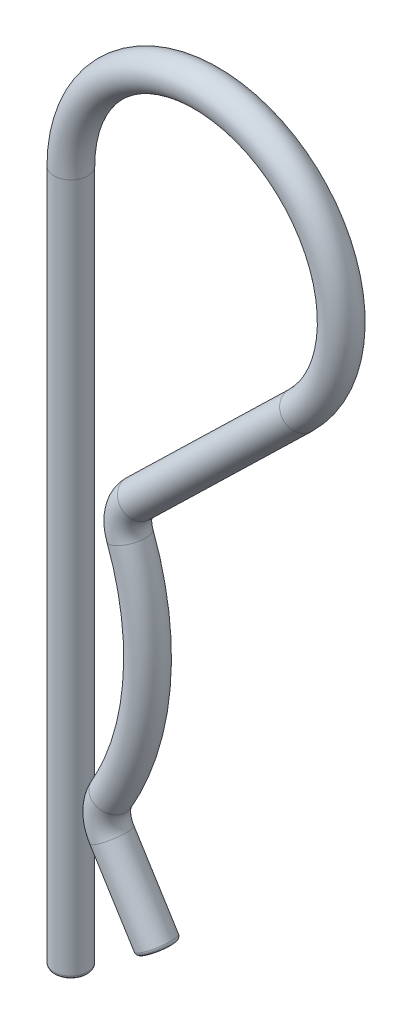
from build123d import *

# Parameters (mm, degrees)
SKETCH_2_R = 1
FILLET_1_R = 0.2


with BuildPart() as part:
    # По траектории1: sweep along a path in Эскиз1
    with BuildLine(Plane.XY) as sweep_1_path:
        Line((-8, -41), (-8, 0))
        ThreePointArc((-8, 0), (3.116806143, 7.367870755), (5.571379866, -5.741056208))
        Line((5.571379866, -5.741056208), (-4.024408845, -15.053242344))
        ThreePointArc((-4.024408845, -15.053242344), (-4.583248798, -16.051555626), (-4.503433283, -17.192853565))
        ThreePointArc((-4.503433283, -17.192853565), (-3.513765144, -24.223447922), (-5.613584589, -31.005737973))
        ThreePointArc((-5.613584589, -31.005737973), (-5.877887723, -32.037194469), (-5.57540957, -33.058108577))
        Line((-5.57540957, -33.058108577), (-2.829700409, -37.462147711))
    # Эскиз2 → По траектории1 (sweep)
    with BuildSketch(Plane(origin=(-8, -41, 0), x_dir=(-1, 0, 0), z_dir=(0, -1, 0))):
        Circle(SKETCH_2_R)
    sweep(path=sweep_1_path.line)

    # Скругление1
    fillet_1_edges = [part.edges().sort_by_distance(p)[0] for p in [
        (-7, -41, 0),
        (-3.678288389, -37.991202, 0),
    ]]
    fillet(fillet_1_edges, radius=FILLET_1_R)


solid = part.part
